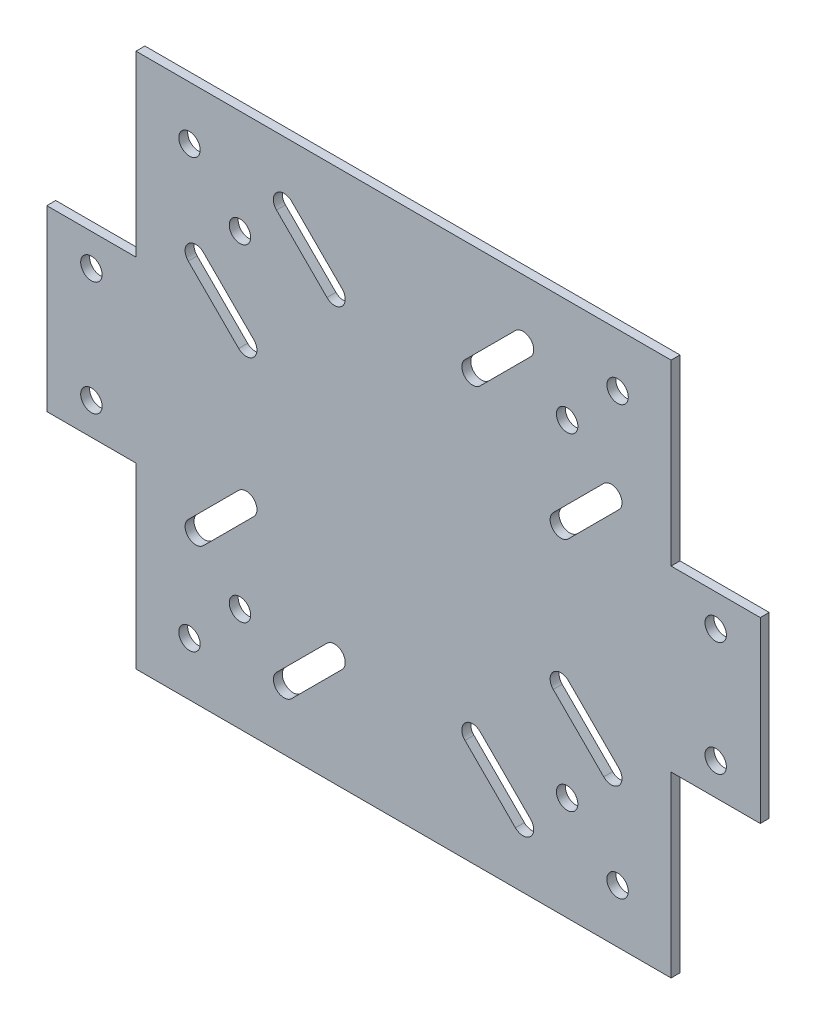
from build123d import *

# Parameters (mm, degrees)
SKETCH1_W           = 300
SKETCH1_H           = 300
SKETCH1_R           = 6
BOSS_EXTRUDE1_DEPTH = 5
SKETCH2_W           = 80
SKETCH2_H           = 100
BOSS_EXTRUDE2_DEPTH = 5
SKETCH3_R           = 6
CUT_EXTRUDE1_DEPTH  = 264


with BuildPart() as part:
    # Sketch1 → Boss-Extrude1 (new body)
    with BuildSketch(Plane.XY):
        Rectangle(SKETCH1_W, SKETCH1_H)
        with Locations((-120, 120)):
            Circle(SKETCH1_R, mode=Mode.SUBTRACT)
        with Locations((120, 120)):
            Circle(SKETCH1_R, mode=Mode.SUBTRACT)
        with Locations((-120, -120)):
            Circle(SKETCH1_R, mode=Mode.SUBTRACT)
        with Locations((120, -120)):
            Circle(SKETCH1_R, mode=Mode.SUBTRACT)
        with Locations((-91.715728753, 91.715728753)):
            Circle(SKETCH1_R, mode=Mode.SUBTRACT)
        with Locations((91.715728753, 91.715728753)):
            Circle(SKETCH1_R, mode=Mode.SUBTRACT)
        with Locations((-91.715728753, -91.715728753)):
            Circle(SKETCH1_R, mode=Mode.SUBTRACT)
        with Locations((91.715728753, -91.715728753)):
            Circle(SKETCH1_R, mode=Mode.SUBTRACT)
        with BuildLine():
            Line((-62.724350724, 120.707106781), (-34.440079476, 92.422835534))
            ThreePointArc((-34.440079476, 92.422835534), (-34.440079476, 83.937554159), (-42.925360851, 83.937554159))
            Line((-42.925360851, 83.937554159), (-71.209632098, 112.221825407))
            ThreePointArc((-71.209632098, 112.221825407), (-71.209632098, 120.707106781), (-62.724350724, 120.707106781))
        make_face(mode=Mode.SUBTRACT)
        with BuildLine():
            Line((71.209632098, 112.221825407), (42.925360851, 83.937554159))
            ThreePointArc((42.925360851, 83.937554159), (34.440079476, 83.937554159), (34.440079476, 92.422835534))
            Line((34.440079476, 92.422835534), (62.724350724, 120.707106781))
            ThreePointArc((62.724350724, 120.707106781), (71.209632098, 120.707106781), (71.209632098, 112.221825407))
        make_face(mode=Mode.SUBTRACT)
        with BuildLine():
            Line((-112.221825407, 71.209632098), (-83.937554159, 42.925360851))
            ThreePointArc((-83.937554159, 42.925360851), (-83.937554159, 34.440079476), (-92.422835534, 34.440079476))
            Line((-92.422835534, 34.440079476), (-120.707106781, 62.724350724))
            ThreePointArc((-120.707106781, 62.724350724), (-120.707106781, 71.209632098), (-112.221825407, 71.209632098))
        make_face(mode=Mode.SUBTRACT)
        with BuildLine():
            Line((120.707106781, 62.724350724), (92.422835534, 34.440079476))
            ThreePointArc((92.422835534, 34.440079476), (83.937554159, 34.440079476), (83.937554159, 42.925360851))
            Line((83.937554159, 42.925360851), (112.221825407, 71.209632098))
            ThreePointArc((112.221825407, 71.209632098), (120.707106781, 71.209632098), (120.707106781, 62.724350724))
        make_face(mode=Mode.SUBTRACT)
        with BuildLine():
            Line((112.221825407, -71.209632098), (83.937554159, -42.925360851))
            ThreePointArc((83.937554159, -42.925360851), (83.937554159, -34.440079476), (92.422835534, -34.440079476))
            Line((92.422835534, -34.440079476), (120.707106781, -62.724350724))
            ThreePointArc((120.707106781, -62.724350724), (120.707106781, -71.209632098), (112.221825407, -71.209632098))
        make_face(mode=Mode.SUBTRACT)
        with BuildLine():
            Line((62.724350724, -120.707106781), (34.440079476, -92.422835534))
            ThreePointArc((34.440079476, -92.422835534), (34.440079476, -83.937554159), (42.925360851, -83.937554159))
            Line((42.925360851, -83.937554159), (71.209632098, -112.221825407))
            ThreePointArc((71.209632098, -112.221825407), (71.209632098, -120.707106781), (62.724350724, -120.707106781))
        make_face(mode=Mode.SUBTRACT)
        with BuildLine():
            Line((-71.209632098, -112.221825407), (-42.925360851, -83.937554159))
            ThreePointArc((-42.925360851, -83.937554159), (-34.440079476, -83.937554159), (-34.440079476, -92.422835534))
            Line((-34.440079476, -92.422835534), (-62.724350724, -120.707106781))
            ThreePointArc((-62.724350724, -120.707106781), (-71.209632098, -120.707106781), (-71.209632098, -112.221825407))
        make_face(mode=Mode.SUBTRACT)
        with BuildLine():
            Line((-120.707106781, -62.724350724), (-92.422835534, -34.440079476))
            ThreePointArc((-92.422835534, -34.440079476), (-83.937554159, -34.440079476), (-83.937554159, -42.925360851))
            Line((-83.937554159, -42.925360851), (-112.221825407, -71.209632098))
            ThreePointArc((-112.221825407, -71.209632098), (-120.707106781, -71.209632098), (-120.707106781, -62.724350724))
        make_face(mode=Mode.SUBTRACT)
    extrude(amount=BOSS_EXTRUDE1_DEPTH)

    # Sketch2 → Boss-Extrude2 (add)
    with BuildSketch(Plane.XY.offset(5)):
        with Locations((-160, 0)):
            Rectangle(SKETCH2_W, SKETCH2_H)
        with Locations((160, 0)):
            Rectangle(SKETCH2_W, SKETCH2_H)
    extrude(amount=-BOSS_EXTRUDE2_DEPTH)

    # Sketch3 → Cut-Extrude1 (cut)
    with BuildSketch(Plane.XY.offset(5)):
        with Locations((-175, 32)):
            Circle(SKETCH3_R)
        with Locations((-175, -32)):
            Circle(SKETCH3_R)
        with Locations((175, 32)):
            Circle(SKETCH3_R)
        with Locations((175, -32)):
            Circle(SKETCH3_R)
    extrude(amount=-CUT_EXTRUDE1_DEPTH, mode=Mode.SUBTRACT)


solid = part.part
